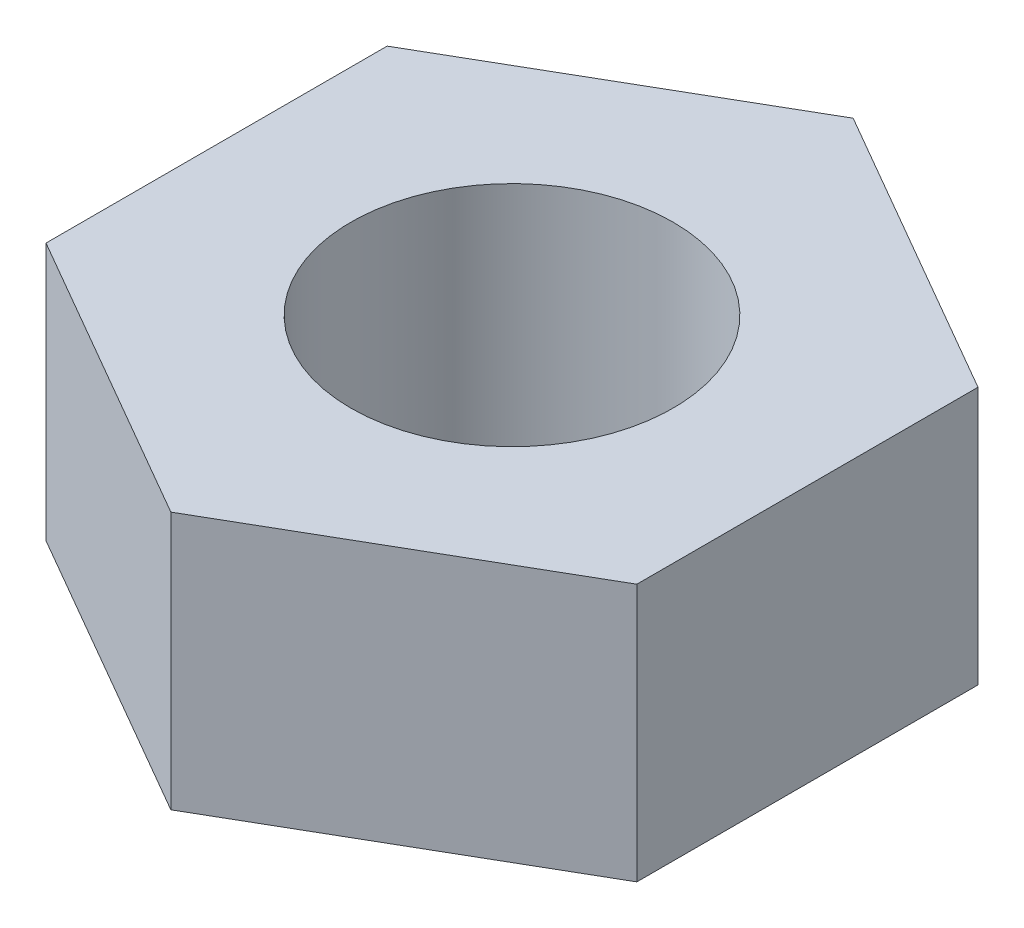
from build123d import *

# Parameters (mm, degrees)
SKETCH_1_R      = 1.5
EXTRUDE_1_DEPTH = 2.4


with BuildPart() as part:
    # Эскиз1 → Бобышка-Вытянуть1 (new body)
    with BuildSketch(Plane(origin=(0, 0, 0), x_dir=(1, 0, 0), z_dir=(0, 1, 0))):
        Polygon((0, 3.175426481), (-2.75, 1.58771324), (-2.75, -1.58771324), (0, -3.175426481), (2.75, -1.58771324), (2.75, 1.58771324), align=None)
        with Locations(Location((0, 0, 0), (0, 0, 270))):
            Circle(SKETCH_1_R, mode=Mode.SUBTRACT)
    extrude(amount=EXTRUDE_1_DEPTH)


solid = part.part
